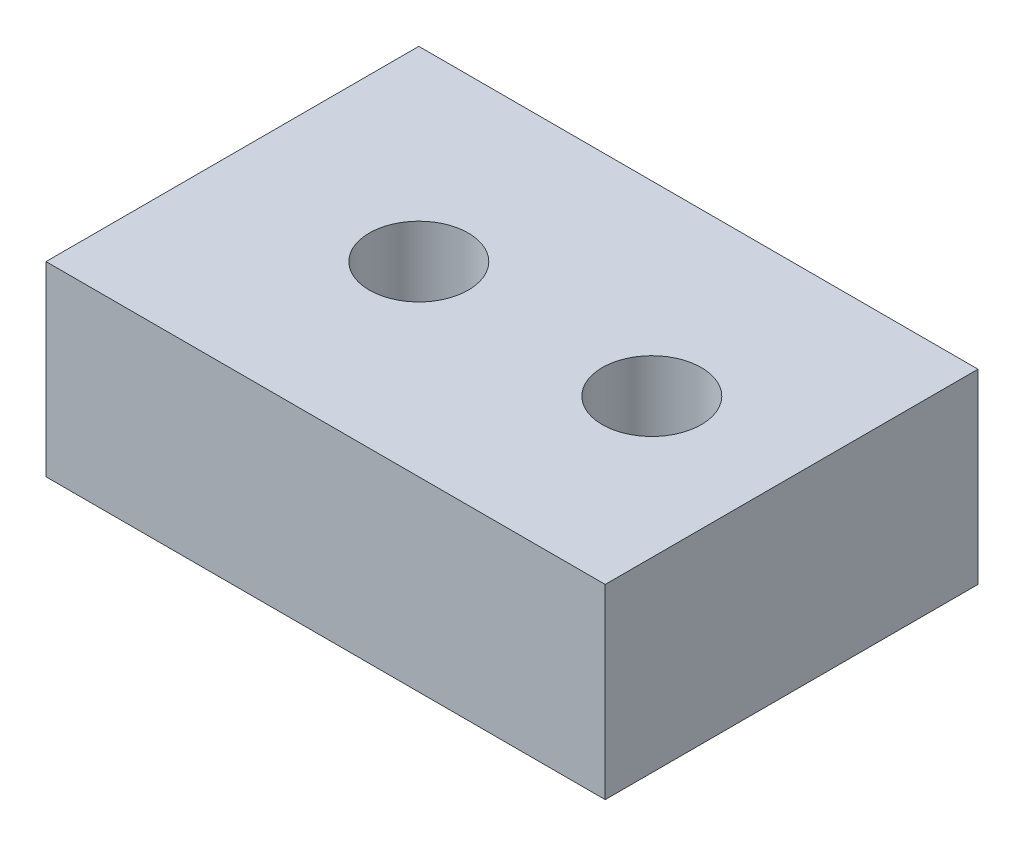
from build123d import *

# Parameters (mm, degrees)
SKETCH1_W           = 38.1
SKETCH1_H           = 25.4
SKETCH1_R           = 3.3734375
BOSS_EXTRUDE1_DEPTH = 12.7


with BuildPart() as part:
    # Sketch1 → Boss-Extrude1 (new body)
    with BuildSketch(Plane(origin=(0, 0, 0), x_dir=(1, 0, 0), z_dir=(0, 1, 0))):
        Rectangle(SKETCH1_W, SKETCH1_H)
        with Locations(Location((-6.35, 0, 0), (0, 0, 270))):
            Circle(SKETCH1_R, mode=Mode.SUBTRACT)
        with Locations(Location((9.525, 0, 0), (0, 0, 270))):
            Circle(SKETCH1_R, mode=Mode.SUBTRACT)
    extrude(amount=BOSS_EXTRUDE1_DEPTH)


solid = part.part
